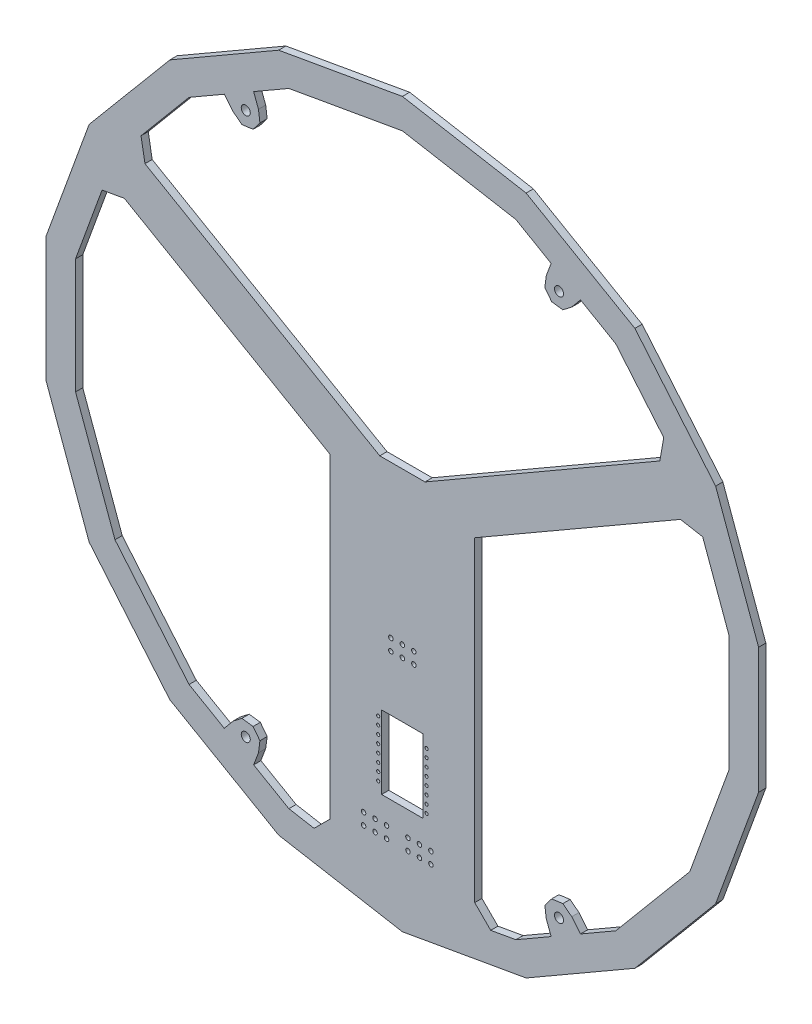
from build123d import *

# Parameters (mm, degrees)
MODEL_R             = 1
MODEL_R_2           = 0.5
MODEL_R_3           = 0.35
MODEL_W             = 9.2
MODEL_H             = 16.2
BOSS_EXTRUDE1_DEPTH = 1.6


with BuildPart() as part:
    # Model → Boss-Extrude1 (new body)
    with BuildSketch(Plane.XY):
        Polygon((-78.78461875, -13.89185), (-69.28203125, -40), (-51.423009375, -61.283559375), (-27.361609375, -75.175409375), (0, -80), (27.361609375, -75.175409375), (51.423009375, -61.283559375), (69.28203125, -40), (78.78461875, -13.89185), (78.78461875, 13.89185), (69.28203125, 40), (51.423009375, 61.283559375), (27.361609375, 75.175409375), (0, 80), (-27.361609375, 75.175409375), (-51.423009375, 61.283559375), (-69.28203125, 40), (-78.78461875, 13.89185), align=None)
        with Locations((34.64, -60)):
            Circle(MODEL_R, mode=Mode.SUBTRACT)
        with Locations((-34.64, 60.01)):
            Circle(MODEL_R, mode=Mode.SUBTRACT)
        with Locations((34.65, 60)):
            Circle(MODEL_R, mode=Mode.SUBTRACT)
        with Locations((-34.64, -60)):
            Circle(MODEL_R, mode=Mode.SUBTRACT)
        with Locations((6.3176, -61.378)):
            Circle(MODEL_R_2, mode=Mode.SUBTRACT)
        with Locations((6.3176, -63.918)):
            Circle(MODEL_R_2, mode=Mode.SUBTRACT)
        with Locations((3.7776, -63.918)):
            Circle(MODEL_R_2, mode=Mode.SUBTRACT)
        with Locations((1.2376, -63.918)):
            Circle(MODEL_R_2, mode=Mode.SUBTRACT)
        with Locations((2.5374, -27.5374)):
            Circle(MODEL_R_2, mode=Mode.SUBTRACT)
        with Locations((-0.0026, -27.5374)):
            Circle(MODEL_R_2, mode=Mode.SUBTRACT)
        with Locations((-2.5426, -27.5374)):
            Circle(MODEL_R_2, mode=Mode.SUBTRACT)
        with Locations((-2.5426, -24.9974)):
            Circle(MODEL_R_2, mode=Mode.SUBTRACT)
        with Locations((2.5374, -24.9974)):
            Circle(MODEL_R_2, mode=Mode.SUBTRACT)
        with Locations((-3.5074, -63.9222)):
            Circle(MODEL_R_2, mode=Mode.SUBTRACT)
        with Locations((-6.0474, -63.9222)):
            Circle(MODEL_R_2, mode=Mode.SUBTRACT)
        with Locations((-8.5874, -63.9222)):
            Circle(MODEL_R_2, mode=Mode.SUBTRACT)
        with Locations((-8.5874, -61.3822)):
            Circle(MODEL_R_2, mode=Mode.SUBTRACT)
        with Locations((-6.0474, -61.3822)):
            Circle(MODEL_R_2, mode=Mode.SUBTRACT)
        with Locations((-3.5074, -61.3822)):
            Circle(MODEL_R_2, mode=Mode.SUBTRACT)
        with Locations((-0.0026, -24.9974)):
            Circle(MODEL_R_2, mode=Mode.SUBTRACT)
        with Locations((1.2376, -61.378)):
            Circle(MODEL_R_2, mode=Mode.SUBTRACT)
        with Locations((3.7776, -61.378)):
            Circle(MODEL_R_2, mode=Mode.SUBTRACT)
        with Locations((-5.35, -43.105)):
            Circle(MODEL_R_3, mode=Mode.SUBTRACT)
        with Locations((-5.35, -44.885)):
            Circle(MODEL_R_3, mode=Mode.SUBTRACT)
        with Locations((-5.35, -46.665)):
            Circle(MODEL_R_3, mode=Mode.SUBTRACT)
        with Locations((-5.35, -48.445)):
            Circle(MODEL_R_3, mode=Mode.SUBTRACT)
        with Locations((-5.35, -50.225)):
            Circle(MODEL_R_3, mode=Mode.SUBTRACT)
        with Locations((-5.35, -52.005)):
            Circle(MODEL_R_3, mode=Mode.SUBTRACT)
        with Locations((-5.35, -53.785)):
            Circle(MODEL_R_3, mode=Mode.SUBTRACT)
        with Locations((5.35, -54.675)):
            Circle(MODEL_R_3, mode=Mode.SUBTRACT)
        with Locations((5.35, -52.895)):
            Circle(MODEL_R_3, mode=Mode.SUBTRACT)
        with Locations((5.35, -51.115)):
            Circle(MODEL_R_3, mode=Mode.SUBTRACT)
        with Locations((5.35, -49.335)):
            Circle(MODEL_R_3, mode=Mode.SUBTRACT)
        with Locations((5.35, -47.555)):
            Circle(MODEL_R_3, mode=Mode.SUBTRACT)
        with Locations((5.35, -45.775)):
            Circle(MODEL_R_3, mode=Mode.SUBTRACT)
        with Locations((5.35, -43.995)):
            Circle(MODEL_R_3, mode=Mode.SUBTRACT)
        with Locations((-5.35, -41.325)):
            Circle(MODEL_R_3, mode=Mode.SUBTRACT)
        with Locations((5.35, -42.215)):
            Circle(MODEL_R_3, mode=Mode.SUBTRACT)
        with Locations((0, -47.9)):
            Rectangle(MODEL_W, MODEL_H, mode=Mode.SUBTRACT)
        Polygon((-72.28461875, -12.74573125), (-63.56603125, -36.699859375), (-47.180440625, -56.22745), (-39.389909375, -60.72531875), (-37.45445, -58.37865), (-35.482740625, -56.865709375), (-33.01871875, -57.1901), (-31.50578125, -59.161809375), (-31.83016875, -61.62583125), (-32.894709375, -64.47531875), (-25.104190625, -68.97318125), (-19.53553125, -69.955090625), (-16, -66.41955), (-16, 3.4641), (-61.494659375, 29.730459375), (-66.4187, 28.86221875), (-72.28461875, 12.74573125), align=None, mode=Mode.SUBTRACT)
        Polygon((16, -66.41955), (19.53553125, -69.955090625), (25.104190625, -68.97318125), (32.894709375, -64.47531875), (31.83016875, -61.62583125), (31.50578125, -59.161809375), (33.01871875, -57.1901), (35.482740625, -56.865709375), (37.45445, -58.37865), (39.389909375, -60.72531875), (47.180440625, -56.22745), (63.56603125, -36.699859375), (72.28461875, -12.74573125), (72.28461875, 12.74573125), (66.4187, 28.86221875), (61.494659375, 29.730459375), (16, 3.4641), align=None, mode=Mode.SUBTRACT)
        Polygon((-57.802509375, 43.568559375), (-56.93426875, 38.64451875), (-5, 8.66025), (5, 8.66025), (56.93426875, 38.64451875), (57.802509375, 43.568559375), (47.180440625, 56.22745), (39.389909375, 60.72531875), (37.45445, 58.37865), (35.482740625, 56.865709375), (33.01871875, 57.1901), (31.50578125, 59.161809375), (31.83016875, 61.62583125), (32.894709375, 64.47531875), (25.104190625, 68.97318125), (0, 73.39973125), (-25.104190625, 68.97318125), (-32.894709375, 64.47531875), (-31.83016875, 61.62583125), (-31.50578125, 59.161809375), (-33.01871875, 57.1901), (-35.482740625, 56.865709375), (-37.45445, 58.37865), (-39.389909375, 60.72531875), (-47.180440625, 56.22745), align=None, mode=Mode.SUBTRACT)
    extrude(amount=BOSS_EXTRUDE1_DEPTH)


solid = part.part
